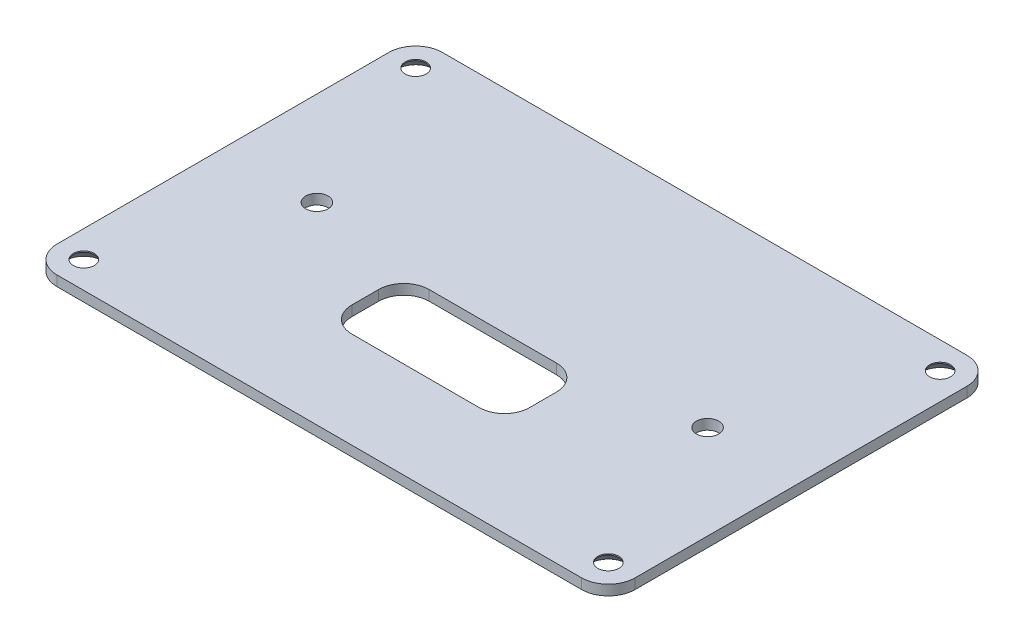
from build123d import *

# Parameters (mm, degrees)
SKETCH2_R                                     = 1
BOSS_EXTRUDE3_DEPTH                           = 1.5875
DB15_PLUG_CUTAWAY_DEPTH                       = 55.106562968
CSK_FOR_4_FLAT_HEAD_MACHINE_SCREW1_AT_2_COUNT = 2
CSK_FOR_4_FLAT_HEAD_MACHINE_SCREW1_AT_2_PITCH = 51.65
CSK_FOR_4_FLAT_HEAD_MACHINE_SCREW1_AT_3_COUNT = 2
CSK_FOR_4_FLAT_HEAD_MACHINE_SCREW1_AT_3_PITCH = 81.65
CSK_FOR_4_FLAT_HEAD_MACHINE_SCREW1_AT_4_COUNT = 2
CSK_FOR_4_FLAT_HEAD_MACHINE_SCREW1_AT_4_PITCH = 96.614931558
SKETCH11_R                                    = 1.7399
CUT_EXTRUDE1_DEPTH                            = 55.106562968


with BuildPart() as part:
    # Sketch2 → Boss-Extrude3 (new body)
    with BuildSketch(Plane(origin=(0, 0, 0), x_dir=(1, 0, 0), z_dir=(0, 1, 0))):
        with BuildLine():
            Line((-45, 25.825), (-45, -25.825))
            ThreePointArc((-45, -25.825), (-43.777170811, -28.777170811), (-40.825, -30))
            Line((-40.825, -30), (40.825, -30))
            ThreePointArc((40.825, -30), (43.777170811, -28.777170811), (45, -25.825))
            Line((45, -25.825), (45, 25.825))
            ThreePointArc((45, 25.825), (43.777170811, 28.777170811), (40.825, 30))
            Line((40.825, 30), (-40.825, 30))
            ThreePointArc((-40.825, 30), (-43.777170811, 28.777170811), (-45, 25.825))
        make_face()
        with Locations(Location((40.825, 25.825, 0), (0, 0, 270))):
            Circle(SKETCH2_R, mode=Mode.SUBTRACT)
        with Locations(Location((-40.825, 25.825, 0), (0, 0, 270))):
            Circle(SKETCH2_R, mode=Mode.SUBTRACT)
        with Locations(Location((-40.825, -25.825, 0), (0, 0, 270))):
            Circle(SKETCH2_R, mode=Mode.SUBTRACT)
        with Locations(Location((40.825, -25.825, 0), (0, 0, 270))):
            Circle(SKETCH2_R, mode=Mode.SUBTRACT)
    extrude(amount=BOSS_EXTRUDE3_DEPTH)

    # Sketch4 → DB15 Plug Cutaway (cut, through all)
    with BuildSketch(Plane.XZ):
        with BuildLine():
            Line((-13.835, 6.924614493), (-13.835, 11.090214492))
            ThreePointArc((-13.835, 11.090214492), (-12.684222543, 13.868437036), (-9.905999998, 15.019214492))
            Line((-9.905999998, 15.019214492), (9.905999999, 15.019214492))
            ThreePointArc((9.905999999, 15.019214492), (12.684222543, 13.868437035), (13.835, 11.090214492))
            Line((13.835, 11.090214492), (13.835, 6.924614492))
            ThreePointArc((13.835, 6.924614492), (12.684222543, 4.146391949), (9.906, 2.995614492))
            Line((9.906, 2.995614492), (-9.905999998, 2.995614492))
            ThreePointArc((-9.905999998, 2.995614492), (-12.684222543, 4.146391948), (-13.835, 6.924614493))
        make_face()
    extrude(amount=-DB15_PLUG_CUTAWAY_DEPTH, mode=Mode.SUBTRACT)

    # Sketch9 → CSK for #4 Flat Head Machine Screw1 (revolve, cut)
    with BuildSketch(Plane(origin=(-40.825, 0, 25.825), x_dir=(0, 0, -1), z_dir=(1, 0, 0))):
        Polygon((0, 0), (0, 1.5875), (1.63195, 1.5875), (1.63195, 1.409834001), (2.8575, 0), align=None)
    csk_for_4_flat_head_machine_screw1 = revolve(axis=Axis((-40.825, -6.35, 25.825), (0, 1, 0)), mode=Mode.SUBTRACT)

    # CSK for #4 Flat Head Machine Screw1 at 2: CSK for #4 Flat Head Machine Screw1 ×2
    with Locations(*[(0, 0, -i * CSK_FOR_4_FLAT_HEAD_MACHINE_SCREW1_AT_2_PITCH) for i in range(1, CSK_FOR_4_FLAT_HEAD_MACHINE_SCREW1_AT_2_COUNT)]):
        add(csk_for_4_flat_head_machine_screw1, mode=Mode.SUBTRACT)

    # CSK for #4 Flat Head Machine Screw1 at 3: CSK for #4 Flat Head Machine Screw1 ×2
    with Locations(*[(i * CSK_FOR_4_FLAT_HEAD_MACHINE_SCREW1_AT_3_PITCH, 0, 0) for i in range(1, CSK_FOR_4_FLAT_HEAD_MACHINE_SCREW1_AT_3_COUNT)]):
        add(csk_for_4_flat_head_machine_screw1, mode=Mode.SUBTRACT)

    # CSK for #4 Flat Head Machine Screw1 at 4: CSK for #4 Flat Head Machine Screw1 ×2
    with Locations(*[Vector(0.8451074661352507, 0, -0.5345964559202167) * (i * CSK_FOR_4_FLAT_HEAD_MACHINE_SCREW1_AT_4_PITCH) for i in range(1, CSK_FOR_4_FLAT_HEAD_MACHINE_SCREW1_AT_4_COUNT)]):
        add(csk_for_4_flat_head_machine_screw1, mode=Mode.SUBTRACT)

    # Sketch11 → Cut-Extrude1 (cut, through all)
    with BuildSketch(Plane.XZ):
        with Locations(Location((-30.382, -0.009017528, 0), (0, 0, 270))):
            Circle(SKETCH11_R)
        with Locations(Location((30.382, -0.061487226, 0), (0, 0, 270))):
            Circle(SKETCH11_R)
    extrude(amount=-CUT_EXTRUDE1_DEPTH, mode=Mode.SUBTRACT)


solid = part.part
